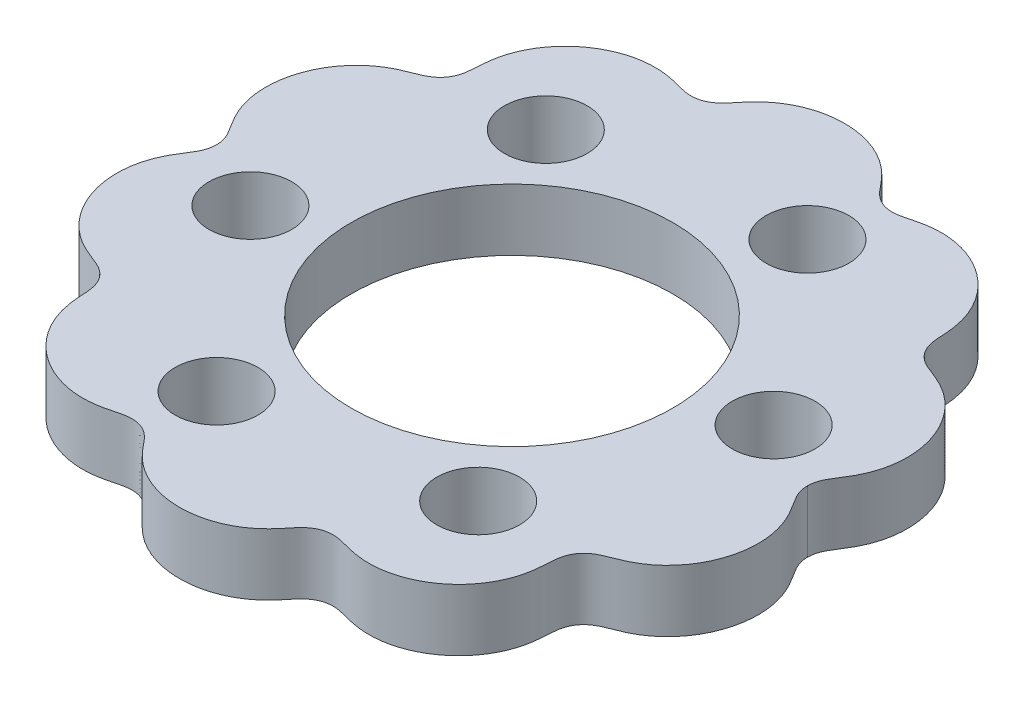
from build123d import *

# Parameters (mm, degrees)
BOSS_EXTRUDE1_DEPTH = 5
SKETCH2_R           = 13.01
CUT_EXTRUDE1_DEPTH  = 38.707841393
SKETCH3_R           = 3.35
CUT_EXTRUDE2_DEPTH  = 38.707841393
CIRPATTERN1_COUNT   = 6


with BuildPart() as part:
    # Sketch1 → Boss-Extrude1 (new body)
    with BuildSketch(Plane(origin=(0, 0, 0), x_dir=(1, 0, 0), z_dir=(0, 1, 0))):
        with BuildLine():
            add(Edge.make_bspline(
                [(23.9, 0), (23.9, -0.016633989), (23.900445322, -0.049716738), (23.903117263, -0.135350435), (23.912449323, -0.258275625), (23.931014764, -0.389664583), (23.95950077, -0.532178366), (23.991965599, -0.654750336), (24.032983907, -0.786511172), (24.083782664, -0.924885773), (24.152134694, -1.082987887), (24.242890991, -1.262939392), (24.344653165, -1.442540166), (24.455160863, -1.62253731), (24.571701309, -1.804480724), (24.718332668, -2.031272436), (24.891440754, -2.305276667), (25.08752709, -2.640233385), (25.293354955, -3.042827983), (25.523356461, -3.575365943), (25.743503693, -4.249070037), (25.90895307, -5.060229623), (25.989021701, -6.239979202), (25.864263399, -7.422194916), (25.541810184, -8.56833506), (25.032271071, -9.642344828), (24.515868766, -10.44509368), (23.898825197, -11.173556713), (23.189250761, -11.812425557), (22.506894507, -12.273540648), (21.894123423, -12.592734858), (21.380382876, -12.81286495), (20.981186658, -12.967022062), (20.508286762, -13.149650453), (20.002819314, -13.392358805), (19.516275612, -13.770444983), (19.107135549, -14.342924661), (18.904436986, -14.938672604), (18.837743288, -15.510825887), (18.811680981, -16.040809437), (18.784521574, -16.489892991), (18.724656278, -17.057834998), (18.596613672, -17.739277292), (18.286978104, -18.742891592), (17.634453661, -19.994985608), (16.567681951, -21.268872628), (15.018746131, -22.380373674), (13.232021309, -23.071186796), (11.686263401, -23.233504295), (10.520948657, -23.10721323), (9.745023474, -22.927131672), (9.331355803, -22.817516456), (8.8414507, -22.687628022), (8.289082778, -22.590399027), (7.675024184, -22.615604046), (7.013991426, -22.842464767), (6.507806015, -23.203624322), (6.123760777, -23.620439494), (5.797319915, -24.026122754), (5.516993379, -24.366413103), (4.988653796, -24.957955887), (4.121749015, -25.716255592), (2.800220177, -26.458949577), (0.986584089, -26.932274503), (-0.892508871, -26.944576885), (-2.492684707, -26.549040992), (-3.758629608, -25.923530552), (-4.601197212, -25.296224361), (-5.106881385, -24.821721344), (-5.490331154, -24.398391643), (-5.776848315, -24.051429867), (-6.109234539, -23.637738359), (-6.497134166, -23.211951019), (-7.00800434, -22.844726368), (-7.673409625, -22.615662906), (-8.289091303, -22.590403621), (-8.841445105, -22.687625059), (-9.331358863, -22.817518065), (-9.745022337, -22.927131075), (-10.520949385, -23.107213612), (-11.686262901, -23.233504033), (-13.232021627, -23.071186963), (-15.018745949, -22.380373578), (-16.567682076, -21.268872694), (-17.63445358, -19.994985565), (-18.286978155, -18.742891619), (-18.596613642, -17.739277276), (-18.724656297, -17.057835008), (-18.784521564, -16.489892985), (-18.811680987, -16.04080944), (-18.837743285, -15.510825885), (-18.904436988, -14.938672605), (-19.107135548, -14.34292466), (-19.516275613, -13.770444984), (-20.002819314, -13.392358805), (-20.508286763, -13.149650453), (-20.981186657, -12.967022061), (-21.380382877, -12.81286495), (-21.894123423, -12.592734858), (-22.506894507, -12.273540648), (-23.189250761, -11.812425557), (-23.898825197, -11.173556713), (-24.515868766, -10.44509368), (-25.032271071, -9.642344828), (-25.541810184, -8.56833506), (-25.864263399, -7.422194916), (-25.989021701, -6.239979202), (-25.90895307, -5.060229623), (-25.743503693, -4.249070037), (-25.523356461, -3.575365943), (-25.293354955, -3.042827983), (-25.08752709, -2.640233385), (-24.891440754, -2.305276667), (-24.718332668, -2.031272436), (-24.571701309, -1.804480724), (-24.455160863, -1.62253731), (-24.344653165, -1.442540166), (-24.242890991, -1.262939392), (-24.152134694, -1.082987887), (-24.083782664, -0.924885773), (-24.032983907, -0.786511172), (-23.991965599, -0.654750336), (-23.95950077, -0.532178365), (-23.931014765, -0.389664584), (-23.912449321, -0.258275624), (-23.903117265, -0.135350437), (-23.900445324, -0.049716739), (-23.9, -0.016633989), (-23.9, 0)],
                knots=[0.076870089, 0.076870089, 0.076870089, 0.076870089, 0.076870089, 0.077626864, 0.078383639, 0.079897189, 0.081410739, 0.082924289, 0.083870594, 0.084816898, 0.086709508, 0.088602118, 0.090494728, 0.092574338, 0.094653949, 0.096733559, 0.09881317, 0.102972391, 0.107131612, 0.111670975, 0.116210339, 0.125289066, 0.134368095, 0.143447123, 0.161604528, 0.17076612, 0.179927712, 0.189089676, 0.19825164, 0.207413052, 0.216574463, 0.220692039, 0.224809615, 0.228927191, 0.233044767, 0.240218222, 0.246328137, 0.252327936, 0.259784753, 0.264113126, 0.268441498, 0.27276987, 0.277098243, 0.286093979, 0.295089716, 0.313081822, 0.331073403, 0.349394218, 0.367715837, 0.386036254, 0.390153136, 0.394270018, 0.398386899, 0.402503781, 0.4096773, 0.415786121, 0.421726112, 0.429062853, 0.433304136, 0.43754542, 0.441786703, 0.446027986, 0.463837747, 0.481648122, 0.499457726, 0.517451628, 0.535445968, 0.544442792, 0.553439616, 0.557768563, 0.562097511, 0.566426458, 0.570755406, 0.578212988, 0.584213879, 0.5903227, 0.597496219, 0.601613101, 0.605729982, 0.609846864, 0.613963746, 0.632284163, 0.650605782, 0.668926597, 0.686918178, 0.704910284, 0.713906021, 0.722901757, 0.72723013, 0.731558502, 0.735886874, 0.740215247, 0.747672064, 0.753671863, 0.759781778, 0.766955233, 0.771072809, 0.775190385, 0.779307961, 0.783425537, 0.792586948, 0.80174836, 0.810910324, 0.820072288, 0.82923388, 0.838395472, 0.856552877, 0.865631905, 0.874710934, 0.883789661, 0.888329025, 0.892868388, 0.897027609, 0.90118683, 0.903266441, 0.905346051, 0.907425662, 0.909505272, 0.911397882, 0.913290492, 0.915183102, 0.916129406, 0.917075711, 0.918589261, 0.920102811, 0.921616361, 0.922373136, 0.923129911, 0.923129911, 0.923129911, 0.923129911, 0.923129911], degree=4))
            add(Edge.make_bspline(
                [(-23.9, 0), (-23.9, 0.016633989), (-23.900445322, 0.049716738), (-23.903117263, 0.135350435), (-23.912449323, 0.258275625), (-23.931014764, 0.389664583), (-23.95950077, 0.532178365), (-23.991965599, 0.654750336), (-24.032983907, 0.786511172), (-24.083782664, 0.924885773), (-24.152134694, 1.082987887), (-24.242890991, 1.262939392), (-24.344653165, 1.442540166), (-24.455160863, 1.62253731), (-24.571701309, 1.804480724), (-24.718332668, 2.031272436), (-24.891440754, 2.305276667), (-25.08752709, 2.640233385), (-25.293354955, 3.042827983), (-25.523356461, 3.575365943), (-25.743503693, 4.249070037), (-25.90895307, 5.060229623), (-25.989021701, 6.239979202), (-25.864263399, 7.422194916), (-25.541810184, 8.56833506), (-25.032271071, 9.642344828), (-24.515868766, 10.44509368), (-23.898825197, 11.173556713), (-23.189250761, 11.812425557), (-22.506894507, 12.273540648), (-21.894123423, 12.592734858), (-21.380382876, 12.81286495), (-20.981186658, 12.967022062), (-20.508286762, 13.149650453), (-20.002819314, 13.392358805), (-19.516275612, 13.770444983), (-19.107135549, 14.342924661), (-18.904436986, 14.938672604), (-18.837743288, 15.510825887), (-18.811680981, 16.040809437), (-18.784521574, 16.489892991), (-18.724656278, 17.057834998), (-18.596613672, 17.739277292), (-18.286978104, 18.742891592), (-17.634453661, 19.994985608), (-16.567681951, 21.268872628), (-15.018746131, 22.380373674), (-13.232021309, 23.071186796), (-11.686263401, 23.233504295), (-10.520948657, 23.10721323), (-9.745023474, 22.927131672), (-9.331355803, 22.817516456), (-8.8414507, 22.687628022), (-8.289082778, 22.590399027), (-7.675024184, 22.615604046), (-7.013991426, 22.842464767), (-6.507806015, 23.203624322), (-6.123760777, 23.620439494), (-5.797319915, 24.026122754), (-5.516993379, 24.366413103), (-4.988653796, 24.957955887), (-4.121749015, 25.716255592), (-2.800220177, 26.458949577), (-0.986584089, 26.932274503), (0.892508871, 26.944576885), (2.492684707, 26.549040992), (3.758629608, 25.923530552), (4.601197212, 25.296224361), (5.106881385, 24.821721344), (5.490331154, 24.398391643), (5.776848315, 24.051429867), (6.109234539, 23.637738359), (6.497134166, 23.211951019), (7.00800434, 22.844726368), (7.673409625, 22.615662906), (8.289091303, 22.590403621), (8.841445105, 22.687625059), (9.331358863, 22.817518065), (9.745022337, 22.927131075), (10.520949385, 23.107213612), (11.686262901, 23.233504033), (13.232021627, 23.071186963), (15.018745949, 22.380373578), (16.567682076, 21.268872694), (17.63445358, 19.994985565), (18.286978155, 18.742891619), (18.596613642, 17.739277276), (18.724656297, 17.057835008), (18.784521564, 16.489892985), (18.811680987, 16.04080944), (18.837743285, 15.510825885), (18.904436988, 14.938672605), (19.107135548, 14.34292466), (19.516275613, 13.770444984), (20.002819314, 13.392358805), (20.508286763, 13.149650453), (20.981186657, 12.967022061), (21.380382877, 12.81286495), (21.894123423, 12.592734858), (22.506894507, 12.273540648), (23.189250761, 11.812425557), (23.898825197, 11.173556713), (24.515868766, 10.44509368), (25.032271071, 9.642344828), (25.541810184, 8.56833506), (25.864263399, 7.422194915), (25.989021701, 6.239979203), (25.90895307, 5.060229621), (25.743503693, 4.249070041), (25.523356461, 3.575365937), (25.293354955, 3.042827994), (25.08752709, 2.640233361), (24.891440754, 2.30527671), (24.718332668, 2.031272365), (24.571701309, 1.804480847), (24.455160863, 1.622537048), (24.344653165, 1.442540618), (24.242890991, 1.262938646), (24.152134694, 1.08298926), (24.083782664, 0.92488324), (24.032983907, 0.786515802), (23.991965599, 0.654738614), (23.95950077, 0.53221509), (23.931014764, 0.389575382), (23.912449323, 0.258442601), (23.903117262, 0.135032083), (23.900445327, 0.050068621), (23.9, 0.01663399), (23.9, 0)],
                knots=[0.076870089, 0.076870089, 0.076870089, 0.076870089, 0.076870089, 0.077626864, 0.078383639, 0.079897189, 0.081410739, 0.082924289, 0.083870594, 0.084816898, 0.086709508, 0.088602118, 0.090494728, 0.092574338, 0.094653949, 0.096733559, 0.09881317, 0.102972391, 0.107131612, 0.111670975, 0.116210339, 0.125289066, 0.134368095, 0.143447123, 0.161604528, 0.17076612, 0.179927712, 0.189089676, 0.19825164, 0.207413052, 0.216574463, 0.220692039, 0.224809615, 0.228927191, 0.233044767, 0.240218222, 0.246328137, 0.252327936, 0.259784753, 0.264113126, 0.268441498, 0.27276987, 0.277098243, 0.286093979, 0.295089716, 0.313081822, 0.331073403, 0.349394218, 0.367715837, 0.386036254, 0.390153136, 0.394270018, 0.398386899, 0.402503781, 0.4096773, 0.415786121, 0.421726112, 0.429062853, 0.433304136, 0.43754542, 0.441786703, 0.446027986, 0.463837747, 0.481648122, 0.499457726, 0.517451628, 0.535445968, 0.544442792, 0.553439616, 0.557768563, 0.562097511, 0.566426458, 0.570755406, 0.578212988, 0.584213879, 0.5903227, 0.597496219, 0.601613101, 0.605729982, 0.609846864, 0.613963746, 0.632284163, 0.650605782, 0.668926597, 0.686918178, 0.704910284, 0.713906021, 0.722901757, 0.72723013, 0.731558502, 0.735886874, 0.740215247, 0.747672064, 0.753671863, 0.759781778, 0.766955233, 0.771072809, 0.775190385, 0.779307961, 0.783425537, 0.792586948, 0.80174836, 0.810910324, 0.820072288, 0.82923388, 0.838395472, 0.856552877, 0.865631905, 0.874710934, 0.883789661, 0.888329025, 0.892868388, 0.897027609, 0.90118683, 0.903266441, 0.905346051, 0.907425662, 0.909505272, 0.911397882, 0.913290492, 0.915183102, 0.916129406, 0.917075711, 0.918589261, 0.920102811, 0.921616361, 0.922373136, 0.923129911, 0.923129911, 0.923129911, 0.923129911, 0.923129911], degree=4))
        make_face()
    extrude(amount=BOSS_EXTRUDE1_DEPTH)

    # Sketch2 → Cut-Extrude1 (cut, through all)
    with BuildSketch(Plane(origin=(0, 5, 0), x_dir=(1, 0, 0), z_dir=(0, 1, 0))):
        with Locations(Location((0, 0, 0), (0, 0, 270))):
            Circle(SKETCH2_R)
    extrude(amount=-CUT_EXTRUDE1_DEPTH, mode=Mode.SUBTRACT)

    # Sketch3 → Cut-Extrude2 (cut, through all)
    with BuildSketch(Plane(origin=(0, 5, 0), x_dir=(1, 0, 0), z_dir=(0, 1, 0))):
        with Locations(Location((18.272234301, 2.894037603, 0), (0, 0, 270))):
            Circle(SKETCH3_R)
    cut_extrude2 = extrude(amount=-CUT_EXTRUDE2_DEPTH, mode=Mode.SUBTRACT)

    # CirPattern1: Cut-Extrude2 ×6 about axis
    cirpattern1_axis = Axis((0, 0, 0), (0, 1, 0))
    for i in range(1, CIRPATTERN1_COUNT):
        add(cut_extrude2.rotate(cirpattern1_axis, i * 360 / CIRPATTERN1_COUNT), mode=Mode.SUBTRACT)


solid = part.part
